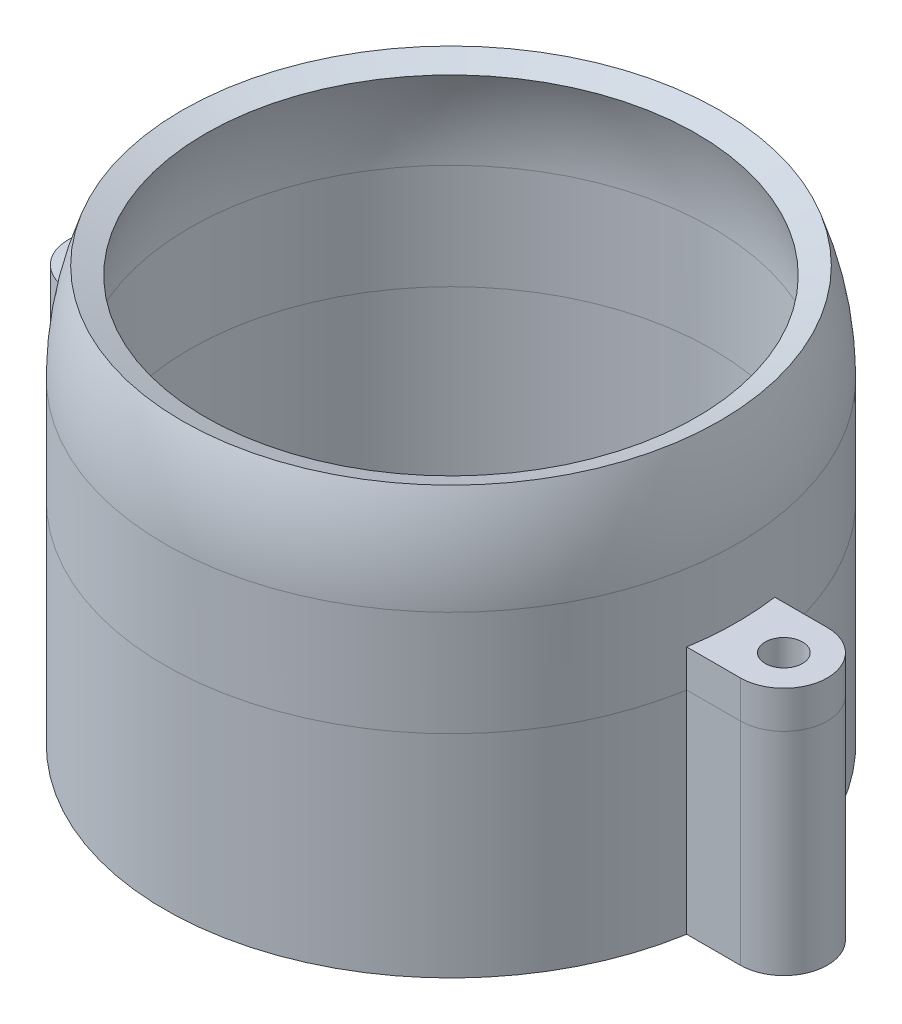
from build123d import *

# Parameters (mm, degrees)
SKETCH5_R           = 1.5
BOSS_EXTRUDE3_DEPTH = 20
CIRPATTERN1_COUNT   = 3


with BuildPart() as part:
    # Sketch4 → Revolve1 (revolve)
    with BuildSketch(Plane.XY):
        with BuildLine():
            Line((-21, 2), (-21, 4))
            Line((-21, 4), (-21, 25.449944321))
            ThreePointArc((-21, 25.449944321), (-20.680962813, 29.096556052), (-19.733545037, 32.63236733))
            Line((-19.733545037, 32.63236733), (-21.612930278, 33.316407617))
            ThreePointArc((-21.612930278, 33.316407617), (-22.650578319, 29.443852407), (-23, 25.449944321))
            Line((-23, 25.449944321), (-23, 0))
            Line((-23, 0), (-21, 0))
            Line((-21, 0), (0, 0))
            Line((0, 0), (0, 4))
            Line((0, 4), (-9.157677286, 4))
            Line((-9.157677286, 4), (-9.157677286, 2))
            Line((-9.157677286, 2), (-21, 2))
        make_face()
    revolve(axis=Axis((0, 25.449944321, 0), (0, -1, 0)))

    # Sketch5 → Boss-Extrude3 (add)
    # profile 1 of 2: a face of its own
    with BuildSketch(Plane(origin=(0, 0, 0), x_dir=(-1, 0, 0), z_dir=(0, -1, 0))):
        with BuildLine():
            Line((27, -3.75), (22.692234355, -3.75))
            ThreePointArc((22.692234355, -3.75), (22.998609049, -0.252946238), (22.769222648, 3.25))
            Line((22.769222648, 3.25), (27, 3.25))
            ThreePointArc((27, 3.25), (30.5, -0.25), (27, -3.75))
        make_face()
        with Locations((27, -0.25)):
            Circle(SKETCH5_R, mode=Mode.SUBTRACT)
    # profile 2 of 2: a face of its own
    with BuildSketch(Plane(origin=(0, 0, 0), x_dir=(-1, 0, 0), z_dir=(0, -1, 0))):
        with BuildLine():
            Line((-27, 3.25), (-22.769222648, 3.25))
            ThreePointArc((-22.769222648, 3.25), (-22.998609049, -0.252946238), (-22.692234355, -3.75))
            Line((-22.692234355, -3.75), (-27, -3.75))
            ThreePointArc((-27, -3.75), (-30.5, -0.25), (-27, 3.25))
        make_face()
        with Locations((-27, -0.25)):
            Circle(SKETCH5_R, mode=Mode.SUBTRACT)
    extrude(amount=-BOSS_EXTRUDE3_DEPTH)

    # Sketch7 → Cut-Revolve1 (revolve, cut)
    with BuildSketch(Plane(origin=(0, 0, 0), x_dir=(1, 0, 0), z_dir=(0, 0, -1))):
        with BuildLine():
            Line((-5, 0), (-8.1, 0))
            Line((-8.1, 0), (-8.1, -3.1))
            ThreePointArc((-8.1, -3.1), (-7.192031022, -5.292031022), (-5, -6.2))
            Line((-5, -6.2), (-5, 0))
        make_face()
    cut_revolve1 = revolve(axis=Axis((-5, 6.2, 0), (0, -1, 0)), mode=Mode.SUBTRACT)

    # CirPattern1: Cut-Revolve1 ×3 about axis
    cirpattern1_axis = Axis((0, 34.982227998, 0), (0, -1, 0))
    for i in range(1, CIRPATTERN1_COUNT):
        add(cut_revolve1.rotate(cirpattern1_axis, i * 360 / CIRPATTERN1_COUNT), mode=Mode.SUBTRACT)


with BuildPart() as body_2:
    # Split1: the piece on the far side of the plane
    add(part.part)
    split(bisect_by=Plane(origin=(0, 17, 0), x_dir=(-1, 0, 0), z_dir=(0, -1, 0)), keep=Keep.BOTTOM)


with BuildPart() as part_1:
    add(part.part)

    # Split1
    split(bisect_by=Plane(origin=(0, 17, 0), x_dir=(-1, 0, 0), z_dir=(0, -1, 0)), keep=Keep.TOP)


solid = Compound([body_2.part, part_1.part])
